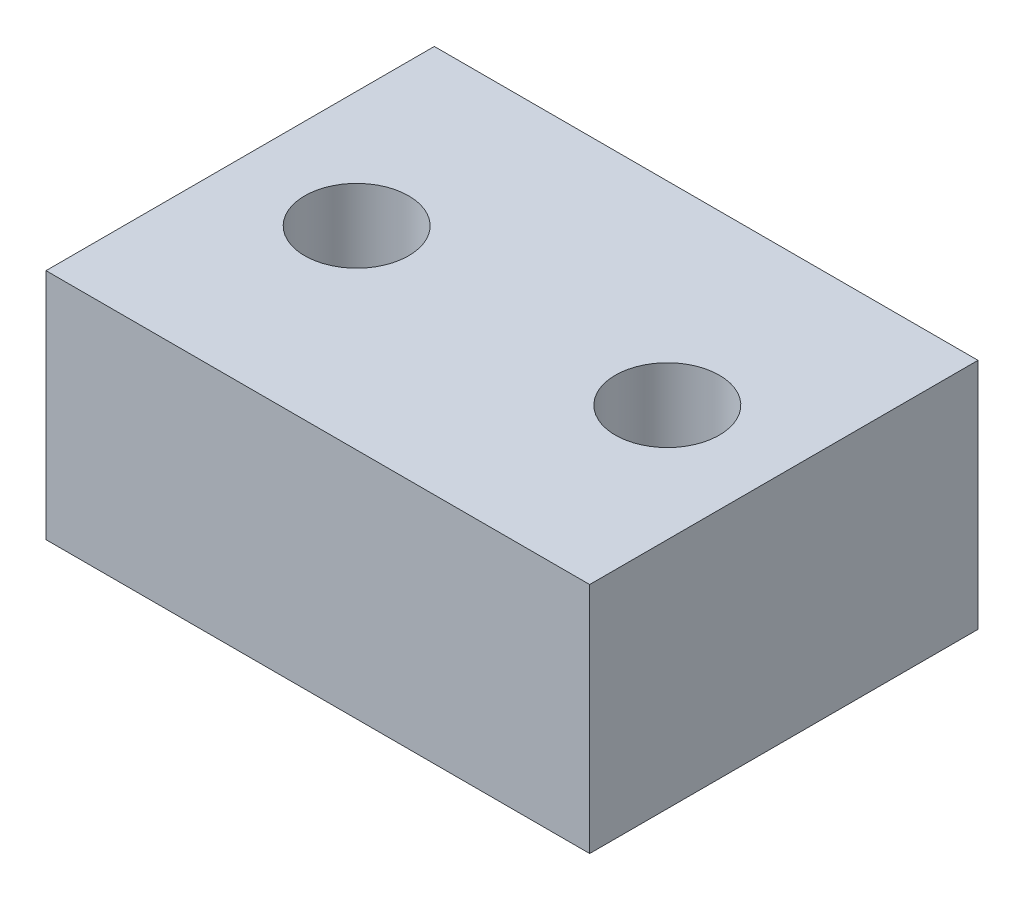
from build123d import *

# Parameters (mm, degrees)
SKETCH1_W           = 17.78
SKETCH1_H           = 12.7
SKETCH1_R           = 1.7
BOSS_EXTRUDE1_DEPTH = 7.62


with BuildPart() as part:
    # Sketch1 → Boss-Extrude1 (new body)
    with BuildSketch(Plane(origin=(0, 0, 0), x_dir=(1, 0, 0), z_dir=(0, 1, 0))):
        with Locations((8.89, 6.35)):
            Rectangle(SKETCH1_W, SKETCH1_H)
        with Locations(Location((3.81, 6.35, 0), (0, 0, 90))):
            Circle(SKETCH1_R, mode=Mode.SUBTRACT)
        with Locations(Location((13.97, 6.35, 0), (0, 0, 90))):
            Circle(SKETCH1_R, mode=Mode.SUBTRACT)
    extrude(amount=BOSS_EXTRUDE1_DEPTH)


solid = part.part
